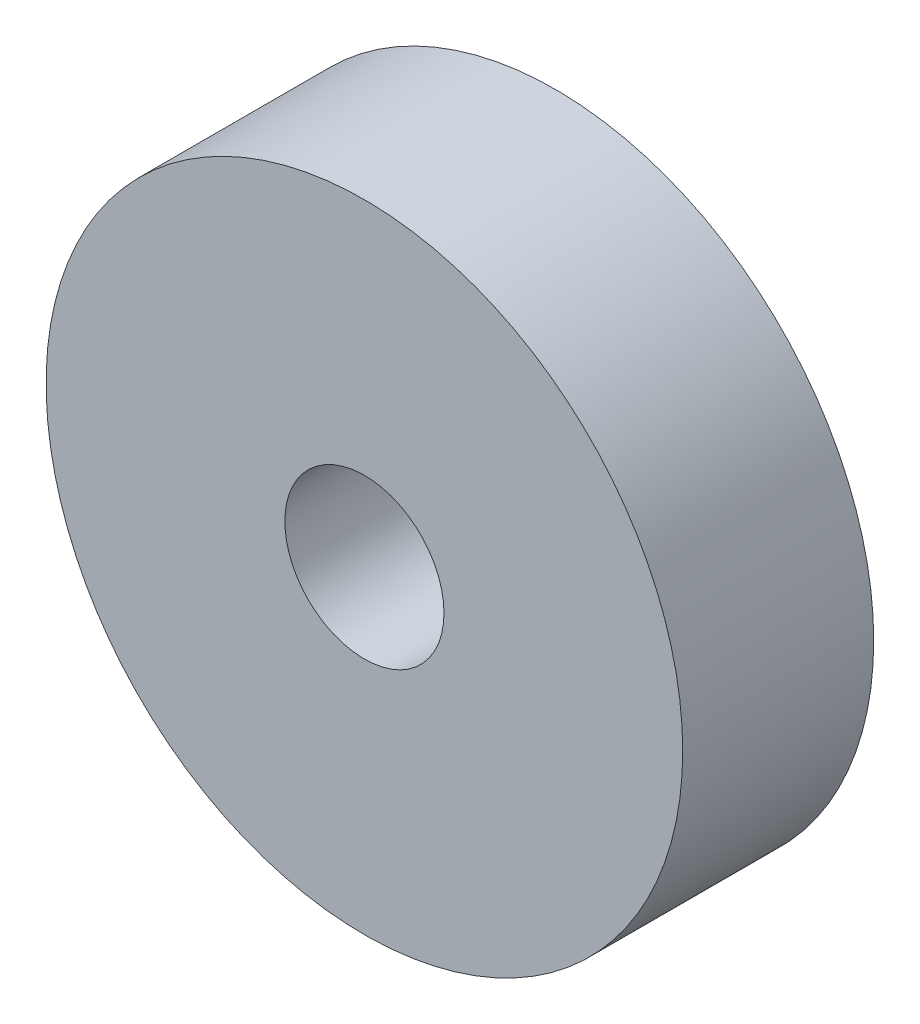
from build123d import *

# Parameters (mm, degrees)
SKETCH1_R           = 5
SKETCH1_R_2         = 1.25
BOSS_EXTRUDE1_DEPTH = 3


with BuildPart() as part:
    # Sketch1 → Boss-Extrude1 (new body)
    with BuildSketch(Plane.XY):
        Circle(SKETCH1_R)
        Circle(SKETCH1_R_2, mode=Mode.SUBTRACT)
    extrude(amount=BOSS_EXTRUDE1_DEPTH)


solid = part.part
